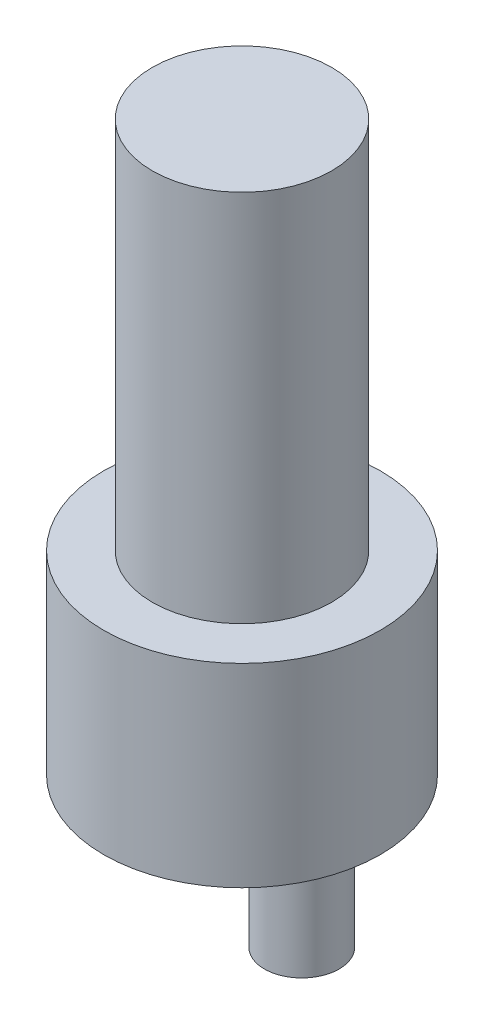
from build123d import *

# Parameters (mm, degrees)
ESBO_O1_R                = 18.5
RESSALTO_EXTRUS_O1_DEPTH = 100
CORTE_EXTRUS_O1_START    = -50
ESBO_O2_R                = 18.5
ESBO_O2_R_2              = 12
CORTE_EXTRUS_O1_DEPTH    = 50
ESBO_O3_R                = 18.5
ESBO_O3_R_2              = 5
CORTE_EXTRUS_O2_DEPTH    = 24


with BuildPart() as part:
    # Esboço1 → Ressalto-extrusão1 (new body)
    with BuildSketch(Plane(origin=(0, 0, 0), x_dir=(1, 0, 0), z_dir=(0, 1, 0))):
        with Locations(Location((0, 0, 0), (0, 0, 270))):
            Circle(ESBO_O1_R)
    extrude(amount=RESSALTO_EXTRUS_O1_DEPTH)

    # Esboço2 → Corte-extrusão1 (cut)
    with BuildSketch(Plane(origin=(0, 100, 0), x_dir=(1, 0, 0), z_dir=(0, 1, 0)).offset(CORTE_EXTRUS_O1_START)):
        with Locations(Location((0, 0, 0), (0, 0, 270))):
            Circle(ESBO_O2_R)
        with Locations(Location((0, 0, 0), (0, 0, 270))):
            Circle(ESBO_O2_R_2, mode=Mode.SUBTRACT)
    extrude(amount=CORTE_EXTRUS_O1_DEPTH, mode=Mode.SUBTRACT)

    # Esboço3 → Corte-extrusão2 (cut)
    with BuildSketch(Plane(origin=(0, 0, 0), x_dir=(-1, 0, 0), z_dir=(0, -1, 0))):
        with Locations(Location((0, 0, 0), (0, 0, 90))):
            Circle(ESBO_O3_R)
        with Locations(Location((0, 8, 0), (0, 0, 90))):
            Circle(ESBO_O3_R_2, mode=Mode.SUBTRACT)
    extrude(amount=-CORTE_EXTRUS_O2_DEPTH, mode=Mode.SUBTRACT)


solid = part.part
